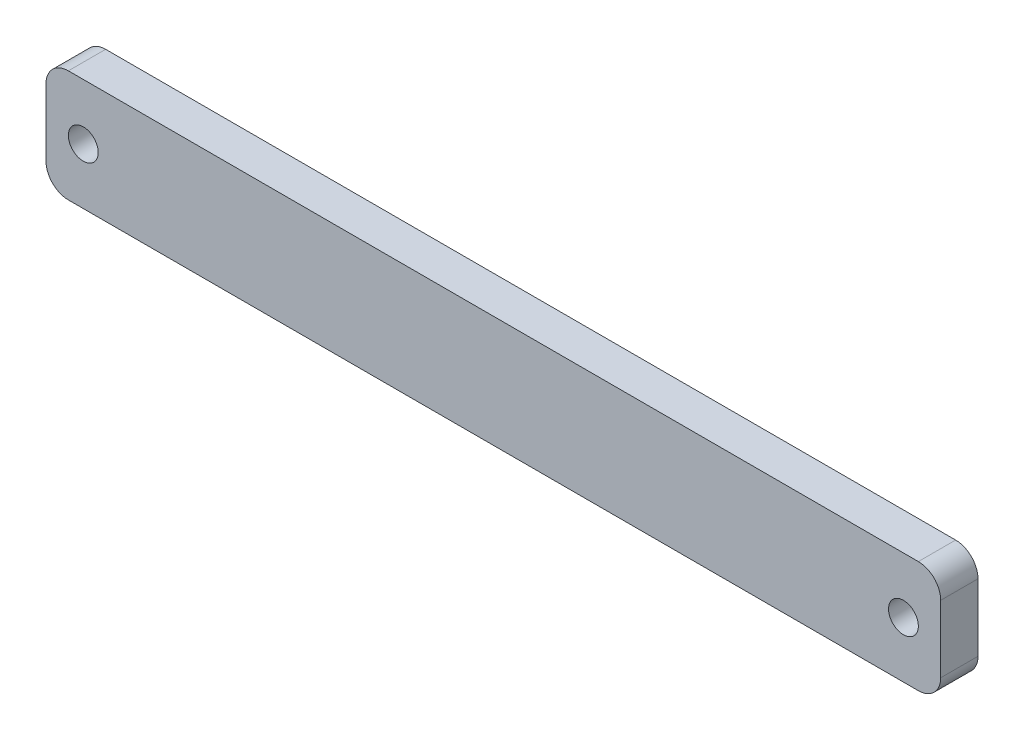
from build123d import *

# Parameters (mm, degrees)
ESQUISSE1_W        = 120
ESQUISSE1_H        = 15
ESQUISSE1_R        = 2
BOSS_EXTRU_1_DEPTH = 5
CONG_1_R           = 3


with BuildPart() as part:
    # Esquisse1 → Boss.-Extru.1 (new body)
    with BuildSketch(Plane.XY):
        Rectangle(ESQUISSE1_W, ESQUISSE1_H)
        with Locations((-55, 0)):
            Circle(ESQUISSE1_R, mode=Mode.SUBTRACT)
        with Locations(Location((55, 0, 0), (0, 0, 180))):
            Circle(ESQUISSE1_R, mode=Mode.SUBTRACT)
    extrude(amount=BOSS_EXTRU_1_DEPTH)

    # Congé1
    cong_1_edges = [part.edges().sort_by_distance(p)[0] for p in [
        (60, -7.5, 2.5),
        (-60, -7.5, 2.5),
        (-60, 7.5, 2.5),
        (60, 7.5, 2.5),
    ]]
    fillet(cong_1_edges, radius=CONG_1_R)


solid = part.part
